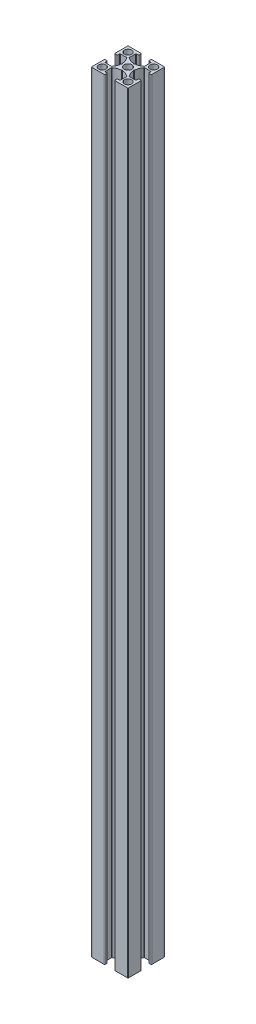
from build123d import *

# Parameters (mm, degrees)
SKETCH_1_R      = 2.15
SKETCH_1_R_2    = 2
EXTRUDE_1_DEPTH = 420


with BuildPart() as part:
    # 스케치1 → 보스-돌출1 (new body)
    with BuildSketch(Plane(origin=(0, 0, 0), x_dir=(1, 0, 0), z_dir=(0, 1, 0))):
        with BuildLine():
            Line((4.15, 4.942749448), (4.15, 8.2))
            ThreePointArc((4.15, 8.2), (4.062132034, 8.412132034), (3.85, 8.5))
            Line((3.85, 8.5), (2.95, 8.5))
            ThreePointArc((2.95, 8.5), (2.737867966, 8.587867966), (2.65, 8.8))
            Line((2.65, 8.8), (2.65, 9.7))
            ThreePointArc((2.65, 9.7), (2.737867966, 9.912132034), (2.95, 10))
            Line((2.95, 10), (9.7, 10))
            ThreePointArc((9.7, 10), (9.912132034, 9.912132034), (10, 9.7))
            Line((10, 9.7), (10, 2.95))
            ThreePointArc((10, 2.95), (9.912132034, 2.737867966), (9.7, 2.65))
            Line((9.7, 2.65), (8.8, 2.65))
            ThreePointArc((8.8, 2.65), (8.587867966, 2.737867966), (8.5, 2.95))
            Line((8.5, 2.95), (8.5, 3.85))
            ThreePointArc((8.5, 3.85), (8.412132034, 4.062132034), (8.2, 4.15))
            Line((8.2, 4.15), (4.942749448, 4.15))
            ThreePointArc((4.942749448, 4.15), (4.812307598, 4.120157221), (4.707817398, 4.03656616))
            ThreePointArc((4.707817398, 4.03656616), (3.714379176, 2.282021525), (3.307277366, 0.307277366))
            Line((3.307277366, 0.307277366), (3, 0))
            Line((3, 0), (3.307277366, -0.307277366))
            ThreePointArc((3.307277366, -0.307277366), (3.714379176, -2.282021525), (4.707817398, -4.03656616))
            ThreePointArc((4.707817398, -4.03656616), (4.812307598, -4.120157221), (4.942749448, -4.15))
            Line((4.942749448, -4.15), (8.2, -4.15))
            ThreePointArc((8.2, -4.15), (8.412132034, -4.062132034), (8.5, -3.85))
            Line((8.5, -3.85), (8.5, -2.95))
            ThreePointArc((8.5, -2.95), (8.587867966, -2.737867966), (8.8, -2.65))
            Line((8.8, -2.65), (9.7, -2.65))
            ThreePointArc((9.7, -2.65), (9.912132034, -2.737867966), (10, -2.95))
            Line((10, -2.95), (10, -9.7))
            ThreePointArc((10, -9.7), (9.912132034, -9.912132034), (9.7, -10))
            Line((9.7, -10), (2.95, -10))
            ThreePointArc((2.95, -10), (2.737867966, -9.912132034), (2.65, -9.7))
            Line((2.65, -9.7), (2.65, -8.8))
            ThreePointArc((2.65, -8.8), (2.737867966, -8.587867966), (2.95, -8.5))
            Line((2.95, -8.5), (3.85, -8.5))
            ThreePointArc((3.85, -8.5), (4.062132034, -8.412132034), (4.15, -8.2))
            Line((4.15, -8.2), (4.15, -4.942749448))
            ThreePointArc((4.15, -4.942749448), (4.120157221, -4.812307598), (4.03656616, -4.707817398))
            ThreePointArc((4.03656616, -4.707817398), (2.282021525, -3.714379176), (0.307277366, -3.307277366))
            Line((0.307277366, -3.307277366), (0, -3))
            Line((0, -3), (-0.307277366, -3.307277366))
            ThreePointArc((-0.307277366, -3.307277366), (-2.282021525, -3.714379176), (-4.03656616, -4.707817398))
            ThreePointArc((-4.03656616, -4.707817398), (-4.120157221, -4.812307598), (-4.15, -4.942749448))
            Line((-4.15, -4.942749448), (-4.15, -8.2))
            ThreePointArc((-4.15, -8.2), (-4.062132034, -8.412132034), (-3.85, -8.5))
            Line((-3.85, -8.5), (-2.95, -8.5))
            ThreePointArc((-2.95, -8.5), (-2.737867966, -8.587867966), (-2.65, -8.8))
            Line((-2.65, -8.8), (-2.65, -9.7))
            ThreePointArc((-2.65, -9.7), (-2.737867966, -9.912132034), (-2.95, -10))
            Line((-2.95, -10), (-9.7, -10))
            ThreePointArc((-9.7, -10), (-9.912132034, -9.912132034), (-10, -9.7))
            Line((-10, -9.7), (-10, -2.95))
            ThreePointArc((-10, -2.95), (-9.912132034, -2.737867966), (-9.7, -2.65))
            Line((-9.7, -2.65), (-8.8, -2.65))
            ThreePointArc((-8.8, -2.65), (-8.587867966, -2.737867966), (-8.5, -2.95))
            Line((-8.5, -2.95), (-8.5, -3.85))
            ThreePointArc((-8.5, -3.85), (-8.412132034, -4.062132034), (-8.2, -4.15))
            Line((-8.2, -4.15), (-4.942749448, -4.15))
            ThreePointArc((-4.942749448, -4.15), (-4.812307598, -4.120157221), (-4.707817398, -4.03656616))
            ThreePointArc((-4.707817398, -4.03656616), (-3.714379176, -2.282021525), (-3.307277366, -0.307277366))
            Line((-3.307277366, -0.307277366), (-3, 0))
            Line((-3, 0), (-3.307277366, 0.307277366))
            ThreePointArc((-3.307277366, 0.307277366), (-3.714379176, 2.282021525), (-4.707817398, 4.03656616))
            ThreePointArc((-4.707817398, 4.03656616), (-4.812307598, 4.120157221), (-4.942749448, 4.15))
            Line((-4.942749448, 4.15), (-8.2, 4.15))
            ThreePointArc((-8.2, 4.15), (-8.412132034, 4.062132034), (-8.5, 3.85))
            Line((-8.5, 3.85), (-8.5, 2.95))
            ThreePointArc((-8.5, 2.95), (-8.587867966, 2.737867966), (-8.8, 2.65))
            Line((-8.8, 2.65), (-9.7, 2.65))
            ThreePointArc((-9.7, 2.65), (-9.912132034, 2.737867966), (-10, 2.95))
            Line((-10, 2.95), (-10, 9.7))
            ThreePointArc((-10, 9.7), (-9.912132034, 9.912132034), (-9.7, 10))
            Line((-9.7, 10), (-2.95, 10))
            ThreePointArc((-2.95, 10), (-2.737867966, 9.912132034), (-2.65, 9.7))
            Line((-2.65, 9.7), (-2.65, 8.8))
            ThreePointArc((-2.65, 8.8), (-2.737867966, 8.587867966), (-2.95, 8.5))
            Line((-2.95, 8.5), (-3.85, 8.5))
            ThreePointArc((-3.85, 8.5), (-4.062132034, 8.412132034), (-4.15, 8.2))
            Line((-4.15, 8.2), (-4.15, 4.942749448))
            ThreePointArc((-4.15, 4.942749448), (-4.120157221, 4.812307598), (-4.03656616, 4.707817398))
            ThreePointArc((-4.03656616, 4.707817398), (-2.282021525, 3.714379176), (-0.307277366, 3.307277366))
            Line((-0.307277366, 3.307277366), (0, 3))
            Line((0, 3), (0.307277366, 3.307277366))
            ThreePointArc((0.307277366, 3.307277366), (2.282021525, 3.714379176), (4.03656616, 4.707817398))
            ThreePointArc((4.03656616, 4.707817398), (4.120157221, 4.812307598), (4.15, 4.942749448))
        make_face()
        with Locations(Location((0, 0, 0), (0, 0, 270))):
            Circle(SKETCH_1_R, mode=Mode.SUBTRACT)
        with Locations(Location((-7, 7, 0), (0, 0, 270))):
            Circle(SKETCH_1_R_2, mode=Mode.SUBTRACT)
        with Locations(Location((-7, -7, 0), (0, 0, 270))):
            Circle(SKETCH_1_R_2, mode=Mode.SUBTRACT)
        with Locations(Location((7, 7, 0), (0, 0, 270))):
            Circle(SKETCH_1_R_2, mode=Mode.SUBTRACT)
        with Locations(Location((7, -7, 0), (0, 0, 270))):
            Circle(SKETCH_1_R_2, mode=Mode.SUBTRACT)
    extrude(amount=EXTRUDE_1_DEPTH)


solid = part.part
